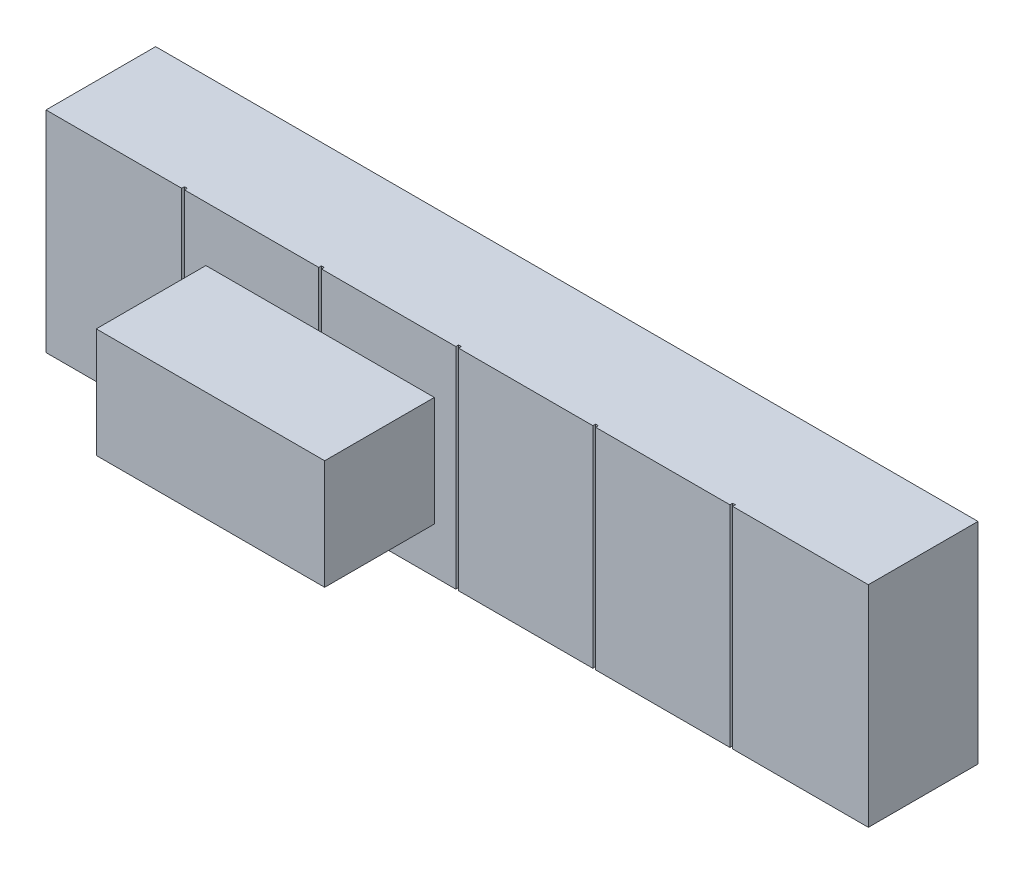
from build123d import *

# Parameters (mm, degrees)
SKETCH1_W           = 900
SKETCH1_H           = 230
BOSS_EXTRUDE1_DEPTH = 120
SKETCH2_W           = 3
SKETCH2_H           = 230
CUT_EXTRUDE1_DEPTH  = 3
SKETCH3_W           = 250
SKETCH3_H           = 120
BOSS_EXTRUDE2_DEPTH = 120


with BuildPart() as part:
    # Sketch1 → Boss-Extrude1 (new body)
    with BuildSketch(Plane.XY):
        Rectangle(SKETCH1_W, SKETCH1_H)
    extrude(amount=BOSS_EXTRUDE1_DEPTH)

    # Sketch2 → Cut-Extrude1 (cut)
    with BuildSketch(Plane.XY.offset(120)):
        with Locations((-300, 0)):
            Rectangle(SKETCH2_W, SKETCH2_H)
        with Locations((-150, 0)):
            Rectangle(SKETCH2_W, SKETCH2_H)
        Rectangle(SKETCH2_W, SKETCH2_H)
        with Locations((150, 0)):
            Rectangle(SKETCH2_W, SKETCH2_H)
        with Locations((300, 0)):
            Rectangle(SKETCH2_W, SKETCH2_H)
    extrude(amount=-CUT_EXTRUDE1_DEPTH, mode=Mode.SUBTRACT)

    # Sketch3 → Boss-Extrude2 (add)
    with BuildSketch(Plane.XY.offset(120)):
        with Locations((-150, -5)):
            Rectangle(SKETCH3_W, SKETCH3_H)
    extrude(amount=BOSS_EXTRUDE2_DEPTH)


solid = part.part
